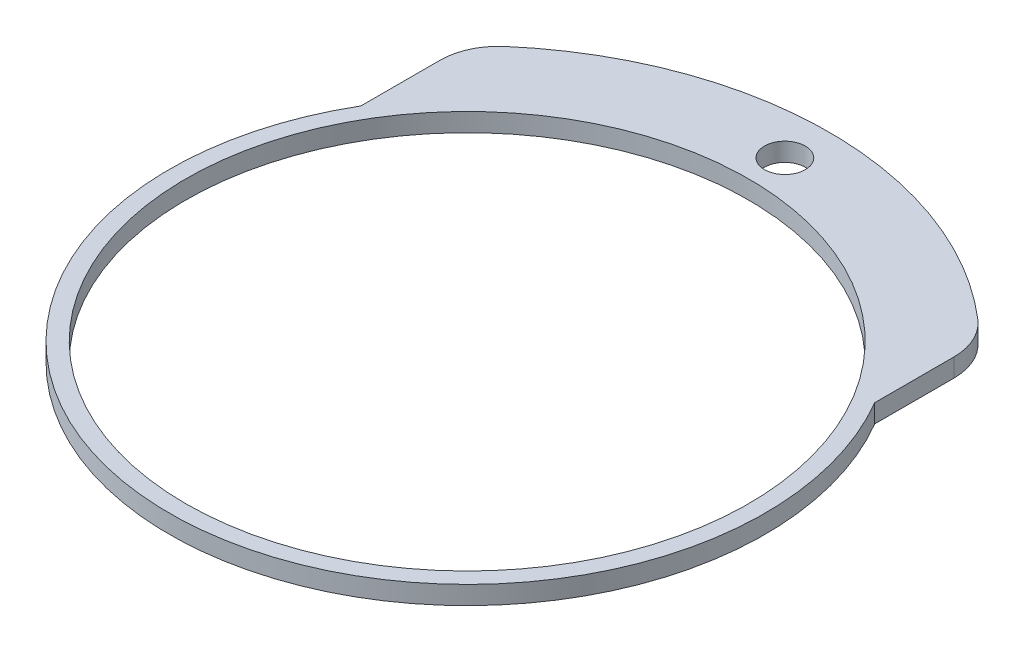
from build123d import *

# Parameters (mm, degrees)
SKETCH1_R           = 32.385
BOSS_EXTRUDE1_DEPTH = 2
FILLET1_R           = 6.35
SKETCH2_R           = 2.2225
CUT_EXTRUDE1_DEPTH  = 52.017498224
SKETCH3_R           = 30.6
CUT_EXTRUDE2_DEPTH  = 52.017498224


with BuildPart() as part:
    # Sketch1 → Boss-Extrude1 (new body)
    with BuildSketch(Plane(origin=(0, 0, 0), x_dir=(1, 0, 0), z_dir=(0, 1, 0))):
        Circle(SKETCH1_R)
        with BuildLine():
            Line((-27.94, 27.737218678), (-27.94, 16.375122137))
            ThreePointArc((-27.94, 16.375122137), (0, 32.385), (27.94, 16.375122137))
            Line((27.94, 16.375122137), (27.94, 27.737218678))
            ThreePointArc((27.94, 27.737218678), (0, 39.37), (-27.94, 27.737218678))
        make_face()
    extrude(amount=BOSS_EXTRUDE1_DEPTH)

    # Fillet1
    fillet1_edges = [part.edges().sort_by_distance(p)[0] for p in [
        (-27.94, 1, -27.737218678),
        (27.94, 1, -27.737218678),
    ]]
    fillet(fillet1_edges, radius=FILLET1_R)

    # Sketch2 → Cut-Extrude1 (cut, through all)
    with BuildSketch(Plane(origin=(0, 2, 0), x_dir=(1, 0, 0), z_dir=(0, 1, 0))):
        with Locations(Location((0, 34.544, 0), (0, 0, 270))):
            Circle(SKETCH2_R)
    extrude(amount=-CUT_EXTRUDE1_DEPTH, mode=Mode.SUBTRACT)

    # Sketch3 → Cut-Extrude2 (cut, through all)
    with BuildSketch(Plane(origin=(0, 2, 0), x_dir=(1, 0, 0), z_dir=(0, 1, 0))):
        with Locations(Location((0, 0, 0), (0, 0, 270))):
            Circle(SKETCH3_R)
    extrude(amount=-CUT_EXTRUDE2_DEPTH, mode=Mode.SUBTRACT)


solid = part.part
